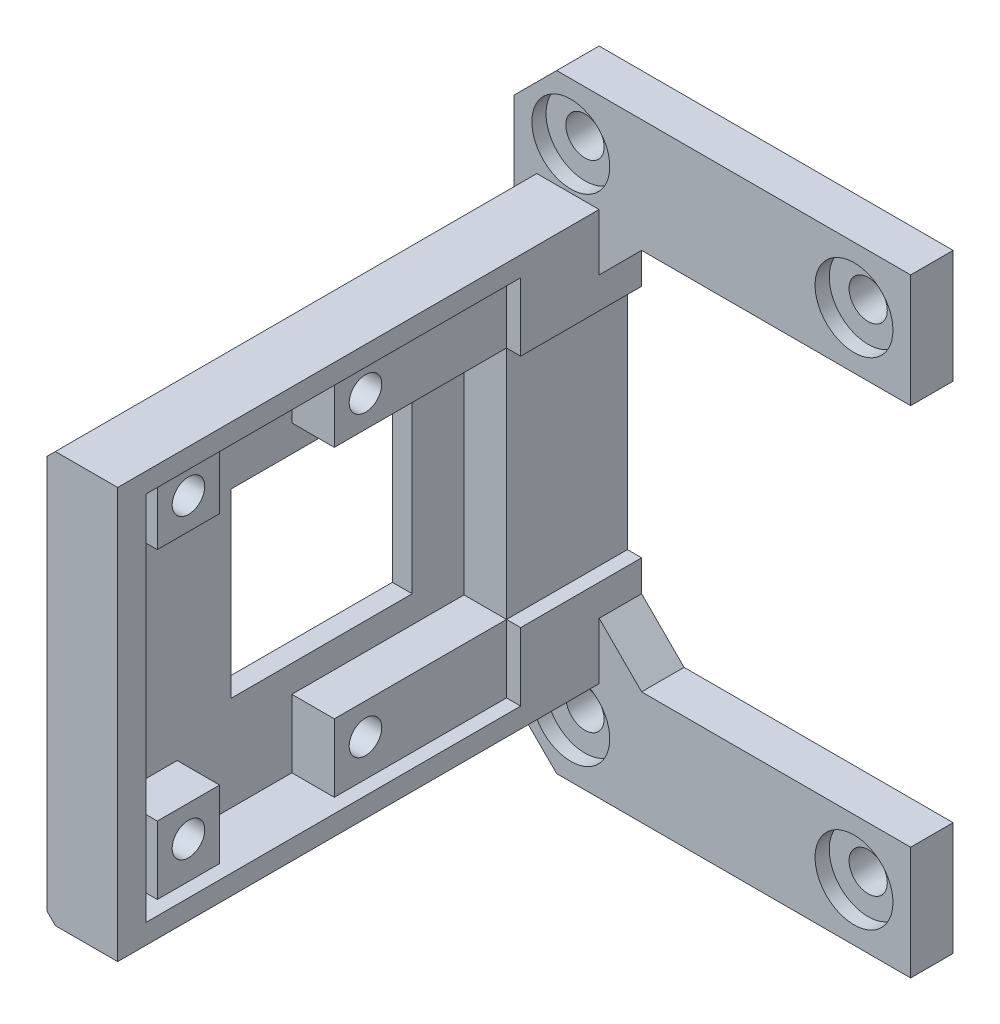
from build123d import *
from build123d.topology import SkipClean

# Parameters (mm, degrees)
BOSS_EXTRUDE1_DEPTH  = 3
SKETCH3_R            = 1.35
CUT_EXTRUDE1_DEPTH   = 69.529190861
SKETCH4_W            = 6
SKETCH4_H            = 27
BOSS_EXTRUDE2_DEPTH  = 32
SKETCH5_R            = 9
CUT_EXTRUDE2_DEPTH   = 50.71166865
SKETCH6_W            = 8
SKETCH6_H            = 25
CUT_EXTRUDE3_DEPTH   = 3
SKETCH7_R            = 2.5
SKETCH7_R_2          = 1.65
BOSS_EXTRUDE3_DEPTH  = 3
CUT_EXTRUDE4_START   = -3
SKETCH8_R            = 1.65
CUT_EXTRUDE4_DEPTH   = 3
CHAMFER1_SIZE        = 0.6
SKETCH9_R            = 2.75
CUT_EXTRUDE5_DEPTH   = 1
CHAMFER2_SIZE        = 3
CHAMFER3_SIZE        = 3
SKETCH10_W           = 32
SKETCH10_H           = 27
CUT_EXTRUDE6_DEPTH   = 20
BOSS_EXTRUDE5_START  = -3
SKETCH11_R           = 1.65
BOSS_EXTRUDE5_DEPTH  = 3
BOSS_EXTRUDE6_START  = -3
BOSS_EXTRUDE6_DEPTH  = 3
BOSS_EXTRUDE7_START  = 3
SKETCH12_R           = 9
BOSS_EXTRUDE7_DEPTH  = 3
SKETCH15_W           = 25.06
SKETCH15_H           = 26.2
CUT_EXTRUDE7_DEPTH   = 4
SKETCH16_W           = 12.8
SKETCH16_H           = 12.8
CUT_EXTRUDE8_DEPTH   = 49.613269793
SKETCH17_W           = 12.16
SKETCH17_H           = 4.8
SKETCH17_W_2         = 4.4
BOSS_EXTRUDE8_DEPTH  = 3
SKETCH18_R           = 1.15
CUT_EXTRUDE9_DEPTH   = 48.077064479
SKETCH19_R           = 2
CUT_EXTRUDE11_DEPTH  = 1.8
CUT_EXTRUDE13_DEPTH  = 0.2
SKETCH21_W           = 2.3
SKETCH21_H           = 2.3
CUT_EXTRUDE14_DEPTH  = 0.2
CHAMFER4_SIZE        = 0.6
SKETCH22_W           = 1.4
SKETCH22_H           = 26.2
CUT_EXTRUDE15_DEPTH  = 4
BOSS_EXTRUDE9_DEPTH  = 32
SKETCH24_W           = 8.54
SKETCH24_H           = 16.6
CUT_EXTRUDE16_DEPTH  = 1
BOSS_EXTRUDE10_DEPTH = 2
CHAMFER5_SIZE        = 1


with BuildPart() as part:
    # Sketch2 → Boss-Extrude1 (new body)
    with BuildSketch(Plane.XY):
        Polygon((-65, 21.5), (-37, 21.5), (-37, 13.5), (-59, 13.5), (-59, -13.5), (-37, -13.5), (-37, -21.5), (-65, -21.5), align=None)
    extrude(amount=BOSS_EXTRUDE1_DEPTH)

    # Sketch3 → Cut-Extrude1 (cut, through all)
    with BuildSketch(Plane.XY.offset(3)):
        with Locations((-41, 17.5)):
            Circle(SKETCH3_R)
        with Locations((-61, 17.5)):
            Circle(SKETCH3_R)
        with Locations((-61, -17.5)):
            Circle(SKETCH3_R)
        with Locations((-41, -17.5)):
            Circle(SKETCH3_R)
    extrude(amount=-CUT_EXTRUDE1_DEPTH, mode=Mode.SUBTRACT)

    # Sketch4 → Boss-Extrude2 (add)
    with BuildSketch(Plane.XY.offset(3)):
        with Locations((-62, 0)):
            Rectangle(SKETCH4_W, SKETCH4_H)
    extrude(amount=BOSS_EXTRUDE2_DEPTH)

    # Sketch5 → Cut-Extrude2 (cut, through all)
    with BuildSketch(Plane.ZY.offset(65)):
        with Locations(Location((23, 0, 0), (0, 0, 270))):
            Circle(SKETCH5_R)
    extrude(amount=-CUT_EXTRUDE2_DEPTH, mode=Mode.SUBTRACT)

    # Sketch6 → Cut-Extrude3 (cut)
    with BuildSketch(Plane(origin=(-59, 0, 0), x_dir=(0, 0, -1), z_dir=(1, 0, 0))):
        with Locations((-23, 0)):
            Rectangle(SKETCH6_W, SKETCH6_H)
    extrude(amount=-CUT_EXTRUDE3_DEPTH, mode=Mode.SUBTRACT)

    # Sketch7 → Boss-Extrude3 (add)
    # profile 1 of 4: a face of its own
    with BuildSketch(Plane(origin=(-59, 0, 0), x_dir=(0, 0, -1), z_dir=(1, 0, 0))):
        with Locations(Location((-30, 10.5, 0), (0, 0, 180))):
            Circle(SKETCH7_R)
        with Locations((-30, 10.5)):
            Circle(SKETCH7_R_2, mode=Mode.SUBTRACT)
    # profile 2 of 4: a face of its own
    with BuildSketch(Plane(origin=(-59, 0, 0), x_dir=(0, 0, -1), z_dir=(1, 0, 0))):
        with Locations(Location((-16, 10.5, 0), (0, 0, 180))):
            Circle(SKETCH7_R)
        with Locations((-16, 10.5)):
            Circle(SKETCH7_R_2, mode=Mode.SUBTRACT)
    # profile 3 of 4: a face of its own
    with BuildSketch(Plane(origin=(-59, 0, 0), x_dir=(0, 0, -1), z_dir=(1, 0, 0))):
        with Locations(Location((-16, -10.5, 0), (0, 0, 180))):
            Circle(SKETCH7_R)
        with Locations((-16, -10.5)):
            Circle(SKETCH7_R_2, mode=Mode.SUBTRACT)
    # profile 4 of 4: a face of its own
    with BuildSketch(Plane(origin=(-59, 0, 0), x_dir=(0, 0, -1), z_dir=(1, 0, 0))):
        with Locations(Location((-30, -10.5, 0), (0, 0, 180))):
            Circle(SKETCH7_R)
        with Locations((-30, -10.5)):
            Circle(SKETCH7_R_2, mode=Mode.SUBTRACT)
    extrude(amount=BOSS_EXTRUDE3_DEPTH)

    # Sketch8 → Cut-Extrude4 (cut)
    with BuildSketch(Plane(origin=(-59, 0, 0), x_dir=(0, 0, -1), z_dir=(1, 0, 0)).offset(CUT_EXTRUDE4_START)):
        with Locations((-30, -10.5)):
            Circle(SKETCH8_R)
        with Locations((-16, -10.5)):
            Circle(SKETCH8_R)
        with Locations((-16, 10.5)):
            Circle(SKETCH8_R)
        with Locations((-30, 10.5)):
            Circle(SKETCH8_R)
    extrude(amount=CUT_EXTRUDE4_DEPTH, mode=Mode.SUBTRACT)

    # Chamfer1
    chamfer1_edges = [part.edges().sort_by_distance(p)[0] for p in [
        (-65, 13.5, 19),
        (-65, -13.5, 19),
    ]]
    chamfer(chamfer1_edges, length=CHAMFER1_SIZE)

    # Sketch9 → Cut-Extrude5 (cut)
    with BuildSketch(Plane.XY.offset(3)):
        with Locations((-61, 17.5)):
            Circle(SKETCH9_R)
        with Locations((-41, 17.5)):
            Circle(SKETCH9_R)
        with Locations((-41, -17.5)):
            Circle(SKETCH9_R)
        with Locations((-61, -17.5)):
            Circle(SKETCH9_R)
    extrude(amount=-CUT_EXTRUDE5_DEPTH, mode=Mode.SUBTRACT)

    # Chamfer2
    chamfer2_edges = [part.edges().sort_by_distance(p)[0] for p in [
        (-59, 13.5, 1.5),
        (-59, -13.5, 1.5),
    ]]
    chamfer(chamfer2_edges, length=CHAMFER2_SIZE)

    # Chamfer3
    chamfer3_edges = [part.edges().sort_by_distance(p)[0] for p in [
        (-65, 21.5, 1.5),
        (-65, -21.5, 1.5),
    ]]
    chamfer(chamfer3_edges, length=CHAMFER3_SIZE)

    # Sketch10 → Cut-Extrude6 (cut)
    with BuildSketch(Plane(origin=(-59, 0, 0), x_dir=(0, 0, -1), z_dir=(1, 0, 0))):
        with Locations((-19, 0)):
            Rectangle(SKETCH10_W, SKETCH10_H)
    extrude(amount=CUT_EXTRUDE6_DEPTH, mode=Mode.SUBTRACT)

    # Sketch11 → Boss-Extrude5 (add)
    with BuildSketch(Plane(origin=(-59, 0, 0), x_dir=(0, 0, -1), z_dir=(1, 0, 0)).offset(BOSS_EXTRUDE5_START)):
        with Locations((-30, 10.5)):
            Circle(SKETCH11_R)
        with Locations((-16, 10.5)):
            Circle(SKETCH11_R)
        with Locations((-16, -10.5)):
            Circle(SKETCH11_R)
        with Locations((-30, -10.5)):
            Circle(SKETCH11_R)
    extrude(amount=BOSS_EXTRUDE5_DEPTH)

    # Sketch11<3> → Boss-Extrude6 (add)
    with BuildSketch(Plane(origin=(-59, 0, 0), x_dir=(0, 0, -1), z_dir=(1, 0, 0)).offset(BOSS_EXTRUDE6_START)):
        with BuildLine():
            ThreePointArc((-27, 8.062257748), (-32, 0), (-27, -8.062257748))
            Line((-27, -8.062257748), (-27, -12.5))
            Line((-27, -12.5), (-19, -12.5))
            Line((-19, -12.5), (-19, -8.062257748))
            ThreePointArc((-19, -8.062257748), (-14, 0), (-19, 8.062257748))
            Line((-19, 8.062257748), (-19, 12.5))
            Line((-19, 12.5), (-27, 12.5))
            Line((-27, 12.5), (-27, 8.062257748))
        make_face()
    extrude(amount=BOSS_EXTRUDE6_DEPTH)

    # Sketch12 → Boss-Extrude7 (add)
    with BuildSketch(Plane.ZY.offset(62).offset(BOSS_EXTRUDE7_START)):
        with Locations((23, 0)):
            Circle(SKETCH12_R)
    extrude(amount=-BOSS_EXTRUDE7_DEPTH)

    # Sketch15 → Cut-Extrude7 (cut)
    with BuildSketch(Plane(origin=(-59, 0, 0), x_dir=(0, 0, -1), z_dir=(1, 0, 0))):
        with Locations((-21.07, 0)):
            Rectangle(SKETCH15_W, SKETCH15_H)
    extrude(amount=-CUT_EXTRUDE7_DEPTH, mode=Mode.SUBTRACT)

    # Sketch16 → Cut-Extrude8 (cut, through all)
    with BuildSketch(Plane(origin=(-63, 0, 0), x_dir=(0, 0, -1), z_dir=(1, 0, 0))):
        with Locations((-18.6, 0)):
            Rectangle(SKETCH16_W, SKETCH16_H)
    extrude(amount=-CUT_EXTRUDE8_DEPTH, mode=Mode.SUBTRACT)

    # Sketch17 → Boss-Extrude8 (add)
    with BuildSketch(Plane(origin=(-63, 0, 0), x_dir=(0, 0, -1), z_dir=(1, 0, 0))):
        with Locations((-14.62, -10.7)):
            Rectangle(SKETCH17_W, SKETCH17_H)
        with Locations((-31, -10.7)):
            Rectangle(SKETCH17_W_2, SKETCH17_H)
        with Locations((-31, 10.7)):
            Rectangle(SKETCH17_W_2, SKETCH17_H)
        with Locations((-14.62, 10.7)):
            Rectangle(SKETCH17_W, SKETCH17_H)
    extrude(amount=BOSS_EXTRUDE8_DEPTH)

    # Sketch18 → Cut-Extrude9 (cut, through all)
    with BuildSketch(Plane(origin=(-60, 0, 0), x_dir=(0, 0, -1), z_dir=(1, 0, 0))):
        with Locations((-31, 10.5)):
            Circle(SKETCH18_R)
        with Locations((-18.5, 10.5)):
            Circle(SKETCH18_R)
        with Locations((-18.5, -10.5)):
            Circle(SKETCH18_R)
        with Locations((-31, -10.5)):
            Circle(SKETCH18_R)
    extrude(amount=-CUT_EXTRUDE9_DEPTH, mode=Mode.SUBTRACT)

    # Sketch19 → Cut-Extrude11 (cut)
    with BuildSketch(Plane.ZY.offset(65)):
        with Locations(Location((18.5, 10.5, 0), (0, 0, 270))):
            Circle(SKETCH19_R)
        with Locations(Location((31, 10.5, 0), (0, 0, 270))):
            Circle(SKETCH19_R)
        with Locations(Location((31, -10.5, 0), (0, 0, 270))):
            Circle(SKETCH19_R)
        with Locations(Location((18.5, -10.5, 0), (0, 0, 270))):
            Circle(SKETCH19_R)
    extrude(amount=-CUT_EXTRUDE11_DEPTH, mode=Mode.SUBTRACT)

    # Sketch20 → Cut-Extrude13 (cut)
    with SkipClean():  # the faces are left unmerged after this step: merging them gives an invalid solid
        with BuildSketch(Plane.ZY.offset(63.2)):
            with BuildLine():
                Line((17.35, 8.863693183), (17.35, 12.136306817))
                ThreePointArc((17.35, 12.136306817), (18.5, 12.5), (19.65, 12.136306817))
                Line((19.65, 12.136306817), (19.65, 8.863693183))
                ThreePointArc((19.65, 8.863693183), (18.5, 8.5), (17.35, 8.863693183))
            make_face()
            with BuildLine():
                Line((29.85, 8.863693183), (29.85, 12.136306817))
                ThreePointArc((29.85, 12.136306817), (31, 12.5), (32.15, 12.136306817))
                Line((32.15, 12.136306817), (32.15, 8.863693183))
                ThreePointArc((32.15, 8.863693183), (31, 8.5), (29.85, 8.863693183))
            make_face()
        cut_extrude13 = extrude(amount=-CUT_EXTRUDE13_DEPTH, mode=Mode.SUBTRACT)

    # Sketch21 → Cut-Extrude14 (cut)
    with SkipClean():  # the faces are left unmerged after this step: merging them gives an invalid solid
        with BuildSketch(Plane.ZY.offset(63)):
            with Locations((18.5, 10.5)):
                Rectangle(SKETCH21_W, SKETCH21_H)
            with Locations((31, 10.5)):
                Rectangle(SKETCH21_W, SKETCH21_H)
        cut_extrude14 = extrude(amount=-CUT_EXTRUDE14_DEPTH, mode=Mode.SUBTRACT)

    # Mirror1: Cut-Extrude13, Cut-Extrude14 across plane
    with SkipClean():  # the faces are left unmerged after this step: merging them gives an invalid solid
        add(cut_extrude13.mirror(Plane.ZX), mode=Mode.SUBTRACT)
        add(cut_extrude14.mirror(Plane.ZX), mode=Mode.SUBTRACT)

    # Chamfer4
    chamfer4_edges = [part.edges().sort_by_distance(p)[0] for p in [
        (-65, 0, 25),
        (-65, 6.4, 18.6),
        (-65, 0, 12.2),
        (-65, -6.4, 18.6),
    ]]
    chamfer(chamfer4_edges, length=CHAMFER4_SIZE)

    # Sketch22 → Cut-Extrude15 (cut)
    with SkipClean():  # the faces are left unmerged after this step: merging them gives an invalid solid
        with BuildSketch(Plane(origin=(-59, 0, 0), x_dir=(0, 0, -1), z_dir=(1, 0, 0))):
            with Locations((-34.3, 0)):
                Rectangle(SKETCH22_W, SKETCH22_H)
        extrude(amount=-CUT_EXTRUDE15_DEPTH, mode=Mode.SUBTRACT)

    # Sketch23 → Boss-Extrude9 (add)
    with SkipClean():  # the faces are left unmerged after this step: merging them gives an invalid solid
        with BuildSketch(Plane.XY.offset(35)):
            Polygon((-64.4, 13.5), (-63.4, 14.5), (-59, 14.5), (-59, 13.5), align=None)
            Polygon((-59, -13.5), (-64.4, -13.5), (-63.4, -14.5), (-59, -14.5), align=None)
        extrude(amount=-BOSS_EXTRUDE9_DEPTH)

    # Sketch24 → Cut-Extrude16 (cut)
    with SkipClean():  # the faces are left unmerged after this step: merging them gives an invalid solid
        with BuildSketch(Plane(origin=(-59, 0, 0), x_dir=(0, 0, -1), z_dir=(1, 0, 0))):
            with Locations((-4.27, 0)):
                Rectangle(SKETCH24_W, SKETCH24_H)
        extrude(amount=-CUT_EXTRUDE16_DEPTH, mode=Mode.SUBTRACT)

    # Sketch27 → Boss-Extrude10 (add)
    with SkipClean():  # the faces are left unmerged after this step: merging them gives an invalid solid
        with BuildSketch(Plane.XY.offset(35)):
            Polygon((-59, 14.5), (-63.4, 14.5), (-65, 12.9), (-65, -12.9), (-63.4, -14.5), (-59, -14.5), align=None)
        extrude(amount=BOSS_EXTRUDE10_DEPTH)

    # Chamfer5
    chamfer5_edges = [part.edges().sort_by_distance(p)[0] for p in [
        (-65, 0, 37),
    ]]
    chamfer(chamfer5_edges, length=CHAMFER5_SIZE)


solid = part.part
